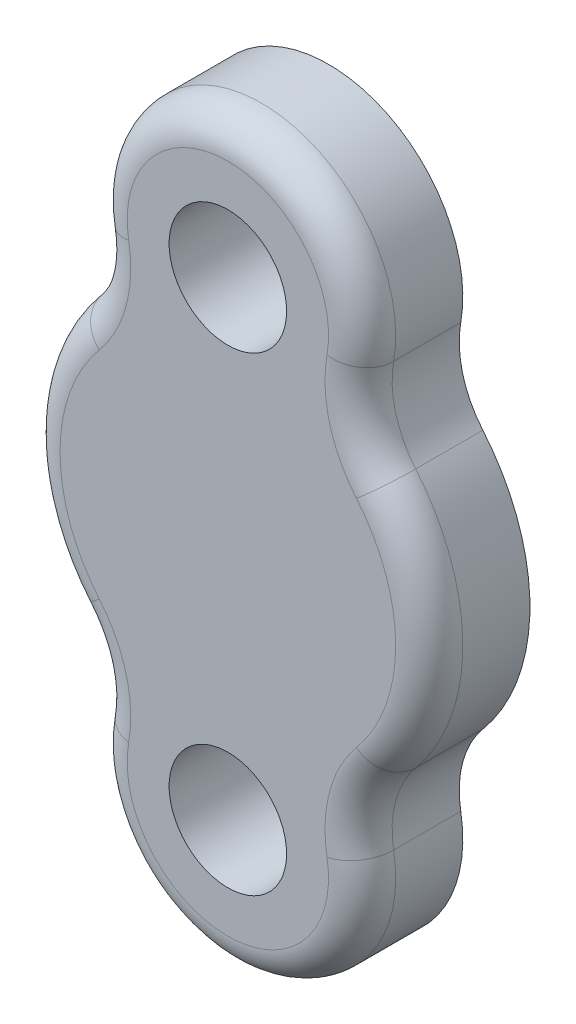
from build123d import *

# Parameters (mm, degrees)
SKETCH1_R           = 1.75
BOSS_EXTRUDE1_DEPTH = 3
FILLET1_R           = 1


with BuildPart() as part:
    # Sketch1 → Boss-Extrude1 (new body)
    with BuildSketch(Plane.XY):
        with BuildLine():
            ThreePointArc((-110.795927452, 3.007150415), (-112.200010897, -0.849992442), (-110.795927452, -4.707135299))
            ThreePointArc((-110.795927452, -4.707135299), (-110.196213999, -5.858855042), (-110.139367944, -7.156114891))
            ThreePointArc((-110.139367944, -7.156114891), (-106.200010897, -11.849992442), (-102.26065385, -7.156114891))
            ThreePointArc((-102.26065385, -7.156114891), (-102.203807795, -5.858855042), (-101.604094342, -4.707135299))
            ThreePointArc((-101.604094342, -4.707135299), (-100.200010897, -0.849992442), (-101.604094342, 3.007150415))
            ThreePointArc((-101.604094342, 3.007150415), (-102.203807795, 4.158870157), (-102.26065385, 5.456130007))
            ThreePointArc((-102.26065385, 5.456130007), (-106.200010897, 10.150007558), (-110.139367944, 5.456130007))
            ThreePointArc((-110.139367944, 5.456130007), (-110.196213999, 4.158870157), (-110.795927452, 3.007150415))
        make_face()
        with Locations((-106.200010897, 6.150007558)):
            Circle(SKETCH1_R, mode=Mode.SUBTRACT)
        with Locations((-106.200010897, -7.849992442)):
            Circle(SKETCH1_R, mode=Mode.SUBTRACT)
    extrude(amount=BOSS_EXTRUDE1_DEPTH)

    # Fillet1
    fillet1_edges = [part.edges().sort_by_distance(p)[0] for p in [
        (-102.203807795, -5.858855042, 3),
        (-100.200010897, -0.849992442, 3),
        (-102.203807795, 4.158870157, 3),
        (-106.200010897, 10.150007558, 3),
        (-110.196213999, 4.158870157, 3),
        (-112.200010897, -0.849992442, 3),
        (-110.196213999, -5.858855042, 3),
        (-106.200010897, -11.849992442, 3),
    ]]
    fillet(fillet1_edges, radius=FILLET1_R)


solid = part.part
